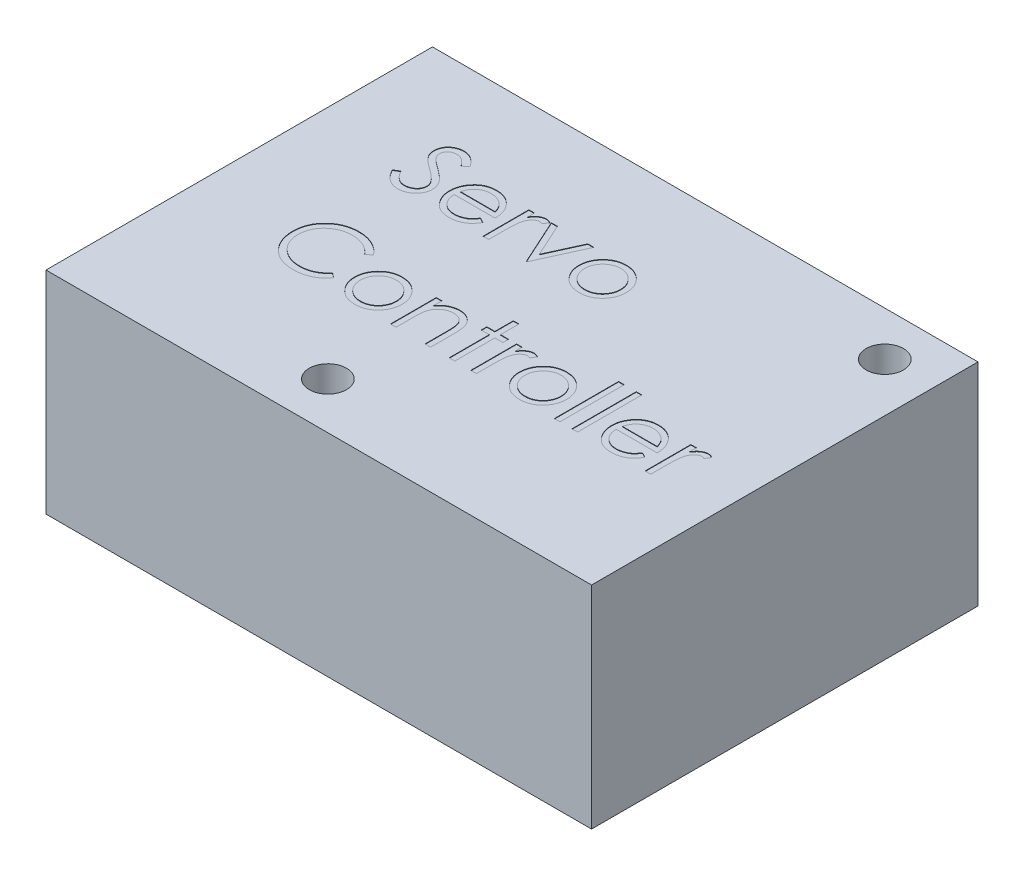
from build123d import *

# Parameters (mm, degrees)
SKETCH1_W                   = 30.48
SKETCH1_H                   = 21.59
BOSS_EXTRUDE1_DEPTH         = 11.811
F_45_0_082_DIAMETER_HOLE1_D = 2.0828
SKETCH6_W                   = 0.314102564
SKETCH6_H                   = 3.589743589
CUT_EXTRUDE1_DEPTH          = 0.0254


with BuildPart() as part:
    # Sketch1 → Boss-Extrude1 (new body)
    with BuildSketch(Plane(origin=(0, 0, 0), x_dir=(1, 0, 0), z_dir=(0, 1, 0))):
        Rectangle(SKETCH1_W, SKETCH1_H)
    extrude(amount=BOSS_EXTRUDE1_DEPTH)

    # #45 (0.082) Diameter Hole1 (through all)
    with Locations(Plane(origin=(0, 0, 0), x_dir=(-1, 0, 0), z_dir=(0, -1, 0))):
        with Locations((2.0955, -8.1915), (-12.5095, 8.3185)):
            Hole(F_45_0_082_DIAMETER_HOLE1_D / 2)

    # Sketch6 → Cut-Extrude1 (cut)
    # profile 1 of 15: a face of its own
    with BuildSketch(Plane(origin=(0, 11.811, 0), x_dir=(1, 0, 0), z_dir=(0, 1, 0))):
        with BuildLine():
            Line((-10.408976815, 3.724664105), (-10.113103417, 3.90204792))
            add(Edge.make_bspline(
                [(-10.113103417, 3.90204792), (-10.08558518, 3.855983535), (-10.0328613, 3.767725951), (-9.94490994, 3.64846791), (-9.853777029, 3.547105753), (-9.758787696, 3.464229146), (-9.660521748, 3.398980259), (-9.558337694, 3.352778027), (-9.452579883, 3.323962052), (-9.380606062, 3.320461966), (-9.34467393, 3.318714586)],
                knots=[0, 0, 0, 0, 1.272034388, 2.437168799, 3.508375237, 4.49857839, 5.41946034, 6.295179144, 7.148887113, 8, 8, 8, 8], degree=3))
            add(Edge.make_bspline(
                [(-9.34467393, 3.318714586), (-9.31398707, 3.319569259), (-9.253150297, 3.321263649), (-9.163588054, 3.337544451), (-9.076606251, 3.36255658), (-8.993997614, 3.398377511), (-8.916901999, 3.441715997), (-8.849295304, 3.494062175), (-8.790849191, 3.55266838), (-8.743040076, 3.618051035), (-8.706360041, 3.688368184), (-8.678167972, 3.760544135), (-8.662522899, 3.835712703), (-8.660166145, 3.886323166), (-8.658976815, 3.911863625)],
                knots=[0, 0, 0, 0, 1.095163259, 2.171163733, 3.241058638, 4.321873601, 5.38011039, 6.391990106, 7.366004449, 8.327778327, 9.272591725, 10.192022065, 11.087607919, 12, 12, 12, 12], degree=3))
            add(Edge.make_bspline(
                [(-8.658976815, 3.911863625), (-8.660451126, 3.941004474), (-8.663448184, 4.000243563), (-8.688779664, 4.087643216), (-8.728628911, 4.174135786), (-8.765391554, 4.227637052), (-8.784477616, 4.255413304)],
                knots=[0, 0, 0, 0, 0.938893495, 1.908633276, 2.914225137, 4, 4, 4, 4], degree=3))
            add(Edge.make_bspline(
                [(-8.784477616, 4.255413304), (-8.80014823, 4.275460128), (-8.833046725, 4.317545926), (-8.889604237, 4.380191162), (-8.955970351, 4.444809581), (-9.029873906, 4.513868638), (-9.114006995, 4.584156434), (-9.20573451, 4.659024712), (-9.307398369, 4.735626289), (-9.378697865, 4.786998855), (-9.415487232, 4.813506253)],
                knots=[0, 0, 0, 0, 0.722233717, 1.516239348, 2.393582979, 3.351407094, 4.387010283, 5.505090956, 6.712668013, 8, 8, 8, 8], degree=3))
            add(Edge.make_bspline(
                [(-9.415487232, 4.813506253), (-9.452311228, 4.83973484), (-9.522715904, 4.889881903), (-9.621174487, 4.964306187), (-9.70921895, 5.032350056), (-9.786457966, 5.094654068), (-9.852857563, 5.151226673), (-9.908940974, 5.201524612), (-9.953279531, 5.246908173), (-9.977935112, 5.276349515), (-9.98900486, 5.289567952)],
                knots=[0, 0, 0, 0, 1.452282411, 2.77665338, 3.964542531, 5.026858415, 5.96415736, 6.766646006, 7.446254459, 8, 8, 8, 8], degree=3))
            add(Edge.make_bspline(
                [(-9.98900486, 5.289567952), (-10.004477405, 5.310168988), (-10.034906242, 5.350683692), (-10.075072247, 5.41400855), (-10.10921141, 5.478831815), (-10.135973742, 5.54532768), (-10.158509961, 5.612562609), (-10.173667892, 5.681413855), (-10.183159289, 5.751572473), (-10.184131275, 5.798785974), (-10.18461784, 5.822420516)],
                knots=[0, 0, 0, 0, 1.068054152, 2.10047183, 3.106115577, 4.101338837, 5.06977816, 6.043150881, 7.020423561, 8, 8, 8, 8], degree=3))
            add(Edge.make_bspline(
                [(-10.18461784, 5.822420516), (-10.183312631, 5.85945029), (-10.180730111, 5.932718354), (-10.158889594, 6.039749184), (-10.124416701, 6.141935602), (-10.076121813, 6.238265935), (-10.01386446, 6.326231916), (-9.941818485, 6.406845403), (-9.856006999, 6.474613985), (-9.761854376, 6.533826044), (-9.658798004, 6.580171969), (-9.5508071, 6.615132949), (-9.437710028, 6.634942207), (-9.361106894, 6.637784972), (-9.322238033, 6.639227407)],
                knots=[0, 0, 0, 0, 1.005424448, 1.989358655, 2.955360095, 3.929531133, 4.905563448, 5.876582895, 6.856512386, 7.866279853, 8.892233794, 9.918561126, 10.94386622, 12, 12, 12, 12], degree=3))
            add(Edge.make_bspline(
                [(-9.322238033, 6.639227407), (-9.280993932, 6.637804855), (-9.198972581, 6.634975854), (-9.078323365, 6.610378323), (-8.962162649, 6.569677651), (-8.868719384, 6.523488993), (-8.795586623, 6.477357577), (-8.73981389, 6.435337753), (-8.683296439, 6.386962644), (-8.625578384, 6.332103398), (-8.567637725, 6.270256647), (-8.508614273, 6.201845958), (-8.448370004, 6.127289402), (-8.409614144, 6.074064902), (-8.389746046, 6.04677949)],
                knots=[0, 0, 0, 0, 1.286793592, 2.559021753, 3.825965368, 5.121522368, 5.803751409, 6.523245864, 7.299691795, 8.125521123, 9.008227632, 9.944561021, 10.946284179, 12, 12, 12, 12], degree=3))
            Line((-8.389746046, 6.04677949), (-8.673700373, 5.831535099))
            add(Edge.make_bspline(
                [(-8.673700373, 5.831535099), (-8.690846305, 5.853623789), (-8.723865362, 5.896161443), (-8.773994849, 5.955732758), (-8.821243497, 6.010149238), (-8.867793897, 6.057414366), (-8.911187528, 6.100116499), (-8.95330457, 6.136676256), (-8.993538922, 6.167451851), (-9.044255832, 6.200295411), (-9.107973551, 6.232851915), (-9.187958087, 6.260400993), (-9.271544362, 6.276956055), (-9.328473993, 6.279144942), (-9.357294123, 6.280253048)],
                knots=[0, 0, 0, 0, 1.181633172, 2.275549214, 3.290209073, 4.226197932, 5.078386478, 5.862611352, 6.581680152, 7.217281963, 8.414376989, 9.595101626, 10.782541182, 12, 12, 12, 12], degree=3))
            add(Edge.make_bspline(
                [(-9.357294123, 6.280253048), (-9.393450645, 6.279041348), (-9.463175092, 6.276704699), (-9.562165328, 6.251184713), (-9.651259254, 6.211002853), (-9.727811819, 6.154687875), (-9.791548796, 6.087966882), (-9.837654254, 6.011188027), (-9.865404419, 5.926405624), (-9.868790699, 5.867263968), (-9.870515276, 5.837144073)],
                knots=[0, 0, 0, 0, 1.14458467, 2.207223713, 3.21896685, 4.227309161, 5.202851033, 6.127160689, 7.046193047, 8, 8, 8, 8], degree=3))
            add(Edge.make_bspline(
                [(-9.870515276, 5.837144073), (-9.87012215, 5.818392595), (-9.869335254, 5.780858975), (-9.858360456, 5.725407553), (-9.844261127, 5.670096214), (-9.821918495, 5.615173631), (-9.791073192, 5.559679272), (-9.750568016, 5.502657535), (-9.699554704, 5.443605826), (-9.660477691, 5.405198452), (-9.639846206, 5.384920516)],
                knots=[0, 0, 0, 0, 0.858281714, 1.717966888, 2.583508476, 3.4729293, 4.427298488, 5.488583878, 6.674047936, 8, 8, 8, 8], degree=3))
            add(Edge.make_bspline(
                [(-9.639846206, 5.384920516), (-9.632184833, 5.37808349), (-9.613983166, 5.361840282), (-9.580707241, 5.335248001), (-9.536764442, 5.302445229), (-9.483302241, 5.261857912), (-9.419334879, 5.21477645), (-9.344855323, 5.161802838), (-9.26069379, 5.101217379), (-9.200971875, 5.058859838), (-9.169393482, 5.036462984)],
                knots=[0, 0, 0, 0, 0.420754252, 0.999615792, 1.744751191, 2.668019286, 3.750313428, 4.999500688, 6.413464383, 8, 8, 8, 8], degree=3))
            add(Edge.make_bspline(
                [(-9.169393482, 5.036462984), (-9.131407568, 5.008821624), (-9.057853112, 4.955297962), (-8.953195532, 4.874882282), (-8.858301724, 4.796234514), (-8.77283852, 4.719856907), (-8.695961612, 4.646328814), (-8.628523891, 4.574765633), (-8.569838211, 4.505680061), (-8.506658992, 4.417107485), (-8.442101173, 4.308326401), (-8.386659665, 4.175048162), (-8.351701318, 4.041251842), (-8.347129802, 3.951325005), (-8.344874251, 3.906955772)],
                knots=[0, 0, 0, 0, 1.163667725, 2.253281268, 3.268753668, 4.215851969, 5.092017293, 5.902905408, 6.650798638, 7.335211899, 8.59617414, 9.77448103, 10.901945474, 12, 12, 12, 12], degree=3))
            add(Edge.make_bspline(
                [(-8.344874251, 3.906955772), (-8.345531389, 3.875577407), (-8.346832904, 3.813430023), (-8.361793818, 3.722174947), (-8.383713483, 3.633544077), (-8.416750717, 3.548632964), (-8.457073875, 3.465888202), (-8.508240123, 3.387480301), (-8.567547808, 3.311673903), (-8.635581573, 3.240490411), (-8.710027475, 3.175144215), (-8.78871117, 3.117015154), (-8.871761443, 3.068546831), (-8.958727759, 3.028995988), (-9.049630096, 2.998062471), (-9.14443788, 2.975649602), (-9.243307391, 2.961893891), (-9.310507873, 2.960466129), (-9.34467393, 2.959740227)],
                knots=[0, 0, 0, 0, 0.983748083, 1.948392443, 2.894712957, 3.844097841, 4.80183111, 5.778335162, 6.776009319, 7.81870978, 8.863265674, 9.881300176, 10.883814829, 11.87499822, 12.874611388, 13.892143829, 14.928324115, 16, 16, 16, 16], degree=3))
            add(Edge.make_bspline(
                [(-9.34467393, 2.959740227), (-9.371109273, 2.960251409), (-9.423647033, 2.961267334), (-9.501356515, 2.970248615), (-9.577496104, 2.982955718), (-9.651110386, 3.003129788), (-9.723147798, 3.027606765), (-9.793295033, 3.057745098), (-9.861586086, 3.093862299), (-9.928403669, 3.135157324), (-9.993577844, 3.183215068), (-10.056497312, 3.239188565), (-10.119226497, 3.30153407), (-10.179913894, 3.371944633), (-10.239787038, 3.449282716), (-10.297665447, 3.5342719), (-10.354747165, 3.626449253), (-10.390562633, 3.691314339), (-10.408976815, 3.724664105)],
                knots=[0, 0, 0, 0, 0.915332311, 1.819136955, 2.706846663, 3.586547465, 4.459518054, 5.340707479, 6.227863349, 7.133153174, 8.059268498, 9.028702269, 10.047606654, 11.120612155, 12.245963614, 13.433783089, 14.680604001, 16, 16, 16, 16], degree=3))
        make_face()
    # profile 2 of 15: a face of its own
    with BuildSketch(Plane(origin=(0, 11.811, 0), x_dir=(1, 0, 0), z_dir=(0, 1, 0))):
        with BuildLine():
            Line((-5.617510469, 3.857176125), (-5.338463994, 3.71064167))
            add(Edge.make_bspline(
                [(-5.338463994, 3.71064167), (-5.36070059, 3.671198338), (-5.403964198, 3.594457235), (-5.478364946, 3.489025375), (-5.556357019, 3.394177659), (-5.641460987, 3.312448005), (-5.731130665, 3.24119662), (-5.82586332, 3.178858795), (-5.926152138, 3.125740275), (-6.032001863, 3.080987747), (-6.144301414, 3.046578253), (-6.26332293, 3.022274032), (-6.389294426, 3.007250763), (-6.475640606, 3.005505622), (-6.519854219, 3.004612022)],
                knots=[0, 0, 0, 0, 1.120438281, 2.179929193, 3.190490725, 4.156257408, 5.095198341, 6.022838206, 6.959905092, 7.901321166, 8.864066838, 9.862729781, 10.905609505, 12, 12, 12, 12], degree=3))
            add(Edge.make_bspline(
                [(-6.519854219, 3.004612022), (-6.568996196, 3.005759197), (-6.664857958, 3.007997004), (-6.804397705, 3.027289469), (-6.935777123, 3.058761827), (-7.058988827, 3.102727369), (-7.173731079, 3.160154693), (-7.280231934, 3.230114175), (-7.37905146, 3.312246429), (-7.467075669, 3.407262873), (-7.546319552, 3.50894483), (-7.616245372, 3.614900715), (-7.674702803, 3.724863939), (-7.722255413, 3.838134463), (-7.760660278, 3.953998357), (-7.787426982, 4.073509824), (-7.80285673, 4.196345408), (-7.805221175, 4.279442744), (-7.806412712, 4.321318753)],
                knots=[0, 0, 0, 0, 1.145258523, 2.234067595, 3.276747158, 4.290159414, 5.277019952, 6.260822364, 7.254936242, 8.264827045, 9.274100331, 10.257902744, 11.220704747, 12.172965371, 13.118907548, 14.062713208, 15.023725156, 16, 16, 16, 16], degree=3))
            add(Edge.make_bspline(
                [(-7.806412712, 4.321318753), (-7.805353571, 4.360613583), (-7.803254493, 4.438490748), (-7.790023705, 4.553756292), (-7.766575412, 4.665784745), (-7.734399088, 4.774669193), (-7.692847842, 4.880227327), (-7.642015623, 4.982523391), (-7.581823245, 5.08144853), (-7.535350571, 5.143851664), (-7.511941558, 5.175285099)],
                knots=[0, 0, 0, 0, 1.024358464, 2.0301432, 3.019427413, 4.004406732, 4.986367066, 5.972626655, 6.978780325, 8, 8, 8, 8], degree=3))
            add(Edge.make_bspline(
                [(-7.511941558, 5.175285099), (-7.480233876, 5.213153969), (-7.417822929, 5.28769212), (-7.312266574, 5.385630445), (-7.197966377, 5.46767422), (-7.076354751, 5.535681357), (-6.946018277, 5.587355004), (-6.808708986, 5.625862586), (-6.6628634, 5.647440597), (-6.563158179, 5.650488431), (-6.512141879, 5.65204792)],
                knots=[0, 0, 0, 0, 1.030682036, 2.02871468, 2.997146059, 3.962720338, 4.930598197, 5.918074684, 6.934738563, 8, 8, 8, 8], degree=3))
            add(Edge.make_bspline(
                [(-6.512141879, 5.65204792), (-6.459694274, 5.650693871), (-6.356804028, 5.648037535), (-6.206771907, 5.623411202), (-6.06481119, 5.584358647), (-5.930978686, 5.529204857), (-5.805260825, 5.458045305), (-5.688474775, 5.369903464), (-5.578623263, 5.267485376), (-5.514714684, 5.188722167), (-5.482193962, 5.148642471)],
                knots=[0, 0, 0, 0, 1.056321875, 2.072262726, 3.055038591, 4.01806755, 4.982017516, 5.957941055, 6.960871419, 8, 8, 8, 8], degree=3))
            add(Edge.make_bspline(
                [(-5.482193962, 5.148642471), (-5.460067024, 5.118438889), (-5.415960431, 5.058232771), (-5.360713331, 4.960061614), (-5.312755936, 4.857351019), (-5.274422975, 4.748440722), (-5.243383474, 4.634621142), (-5.220926655, 4.515078597), (-5.207757036, 4.389848686), (-5.205168339, 4.30452213), (-5.20384861, 4.261022278)],
                knots=[0, 0, 0, 0, 0.94817472, 1.890038105, 2.849395472, 3.817997239, 4.812318967, 5.836947057, 6.897266129, 8, 8, 8, 8], degree=3))
            Line((-5.20384861, 4.261022278), (-7.492310148, 4.261022278))
            add(Edge.make_bspline(
                [(-7.492310148, 4.261022278), (-7.490770542, 4.227321814), (-7.487742968, 4.16105121), (-7.473627825, 4.064080427), (-7.451379051, 3.971707085), (-7.420109988, 3.884624043), (-7.382243143, 3.801693916), (-7.335857426, 3.723531879), (-7.280517872, 3.650493949), (-7.218792173, 3.581926811), (-7.150085078, 3.52086605), (-7.07780233, 3.466214274), (-7.000908765, 3.420408677), (-6.920010682, 3.383228787), (-6.835238897, 3.354122471), (-6.746566702, 3.334254651), (-6.654168585, 3.320947544), (-6.591182851, 3.319467878), (-6.559117039, 3.318714586)],
                knots=[0, 0, 0, 0, 1.094153842, 2.151609401, 3.174256925, 4.172055639, 5.149267565, 6.128595816, 7.11444997, 8.118368179, 9.117203808, 10.09244225, 11.054858984, 12.015122123, 12.976791628, 13.957293641, 14.960065497, 16, 16, 16, 16], degree=3))
            add(Edge.make_bspline(
                [(-6.559117039, 3.318714586), (-6.527765892, 3.319322643), (-6.465559201, 3.320529144), (-6.372918343, 3.332261055), (-6.281778816, 3.35123133), (-6.192517833, 3.377121321), (-6.106946987, 3.408698173), (-6.027701437, 3.44680103), (-5.954821221, 3.488950777), (-5.886704254, 3.537160452), (-5.820633261, 3.596168639), (-5.755090775, 3.66980436), (-5.684814121, 3.756891888), (-5.640824529, 3.822437554), (-5.617510469, 3.857176125)],
                knots=[0, 0, 0, 0, 0.99110716, 1.966546729, 2.947904876, 3.932708344, 4.903319531, 5.828989031, 6.710028674, 7.56322171, 8.463672341, 9.504779593, 10.677557249, 12, 12, 12, 12], degree=3))
        make_face()
        with BuildLine():
            add(Edge.make_bspline(
                [(-5.517951174, 4.575124843), (-5.529447798, 4.616787716), (-5.5515751, 4.696975337), (-5.597811464, 4.808016227), (-5.649883005, 4.906704128), (-5.711504736, 4.992283761), (-5.781323462, 5.068287274), (-5.861968645, 5.13470586), (-5.952404538, 5.194123311), (-6.052163679, 5.24427581), (-6.157805464, 5.286965669), (-6.268411656, 5.315590785), (-6.381269444, 5.335200327), (-6.45760373, 5.337026435), (-6.496016078, 5.337945355)],
                knots=[0, 0, 0, 0, 1.154881502, 2.222775134, 3.210006277, 4.132804581, 5.035138423, 5.962687519, 6.919655026, 7.923214229, 8.944639381, 9.960483929, 10.97369054, 12, 12, 12, 12], degree=3))
            add(Edge.make_bspline(
                [(-6.496016078, 5.337945355), (-6.527365516, 5.337333684), (-6.589336765, 5.336124538), (-6.680637833, 5.324654408), (-6.768317532, 5.305694564), (-6.85302282, 5.279729607), (-6.933643688, 5.245121005), (-7.011838457, 5.204537778), (-7.085618853, 5.154996194), (-7.131760148, 5.117237339), (-7.155070565, 5.098161702)],
                knots=[0, 0, 0, 0, 1.04873581, 2.073130211, 3.073294108, 4.04793562, 5.032784715, 6.005352987, 6.992311501, 8, 8, 8, 8], degree=3))
            add(Edge.make_bspline(
                [(-7.155070565, 5.098161702), (-7.171763847, 5.083067386), (-7.205546981, 5.05252017), (-7.250687503, 4.999890963), (-7.293907975, 4.943139401), (-7.333241628, 4.880094277), (-7.369319214, 4.811473498), (-7.403079192, 4.737855862), (-7.433465604, 4.658682732), (-7.450561714, 4.603510293), (-7.459357424, 4.575124843)],
                knots=[0, 0, 0, 0, 0.879870761, 1.780643979, 2.707998968, 3.669668524, 4.684282772, 5.740141944, 6.837334558, 8, 8, 8, 8], degree=3))
            Line((-7.459357424, 4.575124843), (-5.517951174, 4.575124843))
        make_face(mode=Mode.SUBTRACT)
    # profile 3 of 15: a face of its own
    with BuildSketch(Plane(origin=(0, 11.811, 0), x_dir=(1, 0, 0), z_dir=(0, 1, 0))):
        with BuildLine():
            Line((-4.665387071, 5.607176125), (-4.351284507, 5.607176125))
            Line((-4.351284507, 5.607176125), (-4.351284507, 5.230673721))
            add(Edge.make_bspline(
                [(-4.351284507, 5.230673721), (-4.328095748, 5.265729549), (-4.283747427, 5.332773548), (-4.210034498, 5.421442849), (-4.134531167, 5.494857896), (-4.05687598, 5.553361415), (-3.97649788, 5.597174534), (-3.895160928, 5.629267569), (-3.811585458, 5.648244884), (-3.755423534, 5.650778543), (-3.72728611, 5.65204792)],
                knots=[0, 0, 0, 0, 1.2804753, 2.448899062, 3.506932113, 4.484331642, 5.4025378, 6.288909075, 7.142734305, 8, 8, 8, 8], degree=3))
            add(Edge.make_bspline(
                [(-3.72728611, 5.65204792), (-3.705459783, 5.650857393), (-3.660550698, 5.648407807), (-3.592568108, 5.631196982), (-3.522524656, 5.60371896), (-3.477382269, 5.577878737), (-3.45384861, 5.564407695)],
                knots=[0, 0, 0, 0, 0.901110191, 1.854092781, 2.881294221, 4, 4, 4, 4], degree=3))
            Line((-3.45384861, 5.564407695), (-3.626324571, 5.292372439))
            add(Edge.make_bspline(
                [(-3.626324571, 5.292372439), (-3.641433592, 5.299112705), (-3.670113407, 5.31190702), (-3.712067973, 5.32704903), (-3.75074931, 5.335964946), (-3.775392868, 5.337315664), (-3.786881462, 5.337945355)],
                knots=[0, 0, 0, 0, 1.180555205, 2.24091978, 3.179933427, 4, 4, 4, 4], degree=3))
            add(Edge.make_bspline(
                [(-3.786881462, 5.337945355), (-3.812087196, 5.336265318), (-3.863499586, 5.332838529), (-3.938984085, 5.305899721), (-4.012231291, 5.262374481), (-4.070402953, 5.214103369), (-4.115445206, 5.167555572), (-4.147585431, 5.126907169), (-4.177068178, 5.081328538), (-4.205238399, 5.031598854), (-4.230904693, 4.976869008), (-4.254859362, 4.917685794), (-4.276518225, 4.853980665), (-4.288868469, 4.809598145), (-4.295194764, 4.786863625)],
                knots=[0, 0, 0, 0, 1.125678352, 2.296057538, 3.5422874, 4.923748041, 5.663163013, 6.437101912, 7.23742474, 8.08941207, 8.991984279, 9.93940061, 10.944477711, 12, 12, 12, 12], degree=3))
            add(Edge.make_bspline(
                [(-4.295194764, 4.786863625), (-4.299927157, 4.766586451), (-4.310409049, 4.721674052), (-4.320600586, 4.646325528), (-4.330670104, 4.557301869), (-4.337766723, 4.454355276), (-4.344344765, 4.337742832), (-4.348054847, 4.207286886), (-4.351157988, 4.062853535), (-4.351241055, 3.961879182), (-4.351284507, 3.909059137)],
                knots=[0, 0, 0, 0, 0.566838948, 1.255505196, 2.06880316, 3.007127437, 4.065329342, 5.249902469, 6.561414163, 8, 8, 8, 8], degree=3))
            Line((-4.351284507, 3.909059137), (-4.351284507, 3.049483817))
            Line((-4.351284507, 3.049483817), (-4.665387071, 3.049483817))
            Line((-4.665387071, 3.049483817), (-4.665387071, 5.607176125))
        make_face()
    # profile 4 of 15: a face of its own
    with BuildSketch(Plane(origin=(0, 11.811, 0), x_dir=(1, 0, 0), z_dir=(0, 1, 0))):
        Polygon((-3.408976815, 5.607176125), (-3.068932744, 5.607176125), (-2.219874251, 3.744996637), (-1.370815757, 5.607176125), (-1.030771687, 5.607176125), (-2.197438353, 3.049483817), (-2.242310148, 3.049483817), align=None)
    # profile 5 of 15: a face of its own
    with BuildSketch(Plane(origin=(0, 11.811, 0), x_dir=(1, 0, 0), z_dir=(0, 1, 0))):
        with BuildLine():
            add(Edge.make_bspline(
                [(0.743066454, 5.65204792), (0.791057727, 5.651026028), (0.885156885, 5.64902235), (1.022964771, 5.627607384), (1.154509907, 5.59486002), (1.280296099, 5.549588457), (1.398712394, 5.488906507), (1.511483638, 5.416497216), (1.618300647, 5.330714622), (1.682323676, 5.264356554), (1.714821262, 5.230673721)],
                knots=[0, 0, 0, 0, 1.054011418, 2.066658804, 3.057071809, 4.030435133, 4.997543892, 5.974964718, 6.972108034, 8, 8, 8, 8], degree=3))
            add(Edge.make_bspline(
                [(1.714821262, 5.230673721), (1.742803216, 5.198459735), (1.798225596, 5.134655193), (1.869291315, 5.03119958), (1.930512875, 4.924059479), (1.979575836, 4.811812153), (2.01826086, 4.695437481), (2.045726556, 4.57453547), (2.062063491, 4.449373123), (2.064266458, 4.364369285), (2.06538216, 4.321318753)],
                knots=[0, 0, 0, 0, 1.025258237, 2.030674902, 3.01204498, 3.988269485, 4.97094183, 5.956517959, 6.965070386, 8, 8, 8, 8], degree=3))
            add(Edge.make_bspline(
                [(2.06538216, 4.321318753), (2.064400822, 4.278018695), (2.062461654, 4.192455762), (2.044118037, 4.066436396), (2.015586952, 3.944241573), (1.974755113, 3.82638288), (1.922397004, 3.712500052), (1.858506317, 3.603090503), (1.782634699, 3.49793837), (1.696630703, 3.397936531), (1.601578827, 3.305770317), (1.498462678, 3.225442047), (1.389308645, 3.156620523), (1.272665291, 3.101184107), (1.149597804, 3.057474407), (1.019840736, 3.02677439), (0.883595666, 3.008212707), (0.790568445, 3.005829133), (0.743066454, 3.004612022)],
                knots=[0, 0, 0, 0, 0.998656419, 1.973391657, 2.932242238, 3.890759089, 4.846373663, 5.82037756, 6.809684879, 7.83454468, 8.860553229, 9.859544525, 10.845671541, 11.83227036, 12.833544569, 13.85385346, 14.904124723, 16, 16, 16, 16], degree=3))
            add(Edge.make_bspline(
                [(0.743066454, 3.004612022), (0.695331735, 3.005833218), (0.601840875, 3.008224993), (0.465114893, 3.026702276), (0.335125274, 3.057460258), (0.211896676, 3.101327751), (0.094751829, 3.156622295), (-0.015034668, 3.225233984), (-0.118234584, 3.305794139), (-0.213306568, 3.397930076), (-0.299305173, 3.497940033), (-0.375178182, 3.603090071), (-0.439068508, 3.712500165), (-0.491426712, 3.82638285), (-0.532258525, 3.944241581), (-0.560789617, 4.066436394), (-0.579133232, 4.192455762), (-0.5810724, 4.278018695), (-0.582053738, 4.321318753)],
                knots=[0, 0, 0, 0, 1.099876186, 2.154163076, 3.173186993, 4.173200201, 5.163417411, 6.152872554, 7.150605724, 8.17532212, 9.198891216, 10.186952605, 11.159729845, 12.11414092, 13.071450619, 14.029093627, 15.002601286, 16, 16, 16, 16], degree=3))
            add(Edge.make_bspline(
                [(-0.582053738, 4.321318753), (-0.580930428, 4.364135299), (-0.578706466, 4.448904701), (-0.562385957, 4.573831762), (-0.535027401, 4.694529151), (-0.496296004, 4.810454627), (-0.446780813, 4.922210063), (-0.386419525, 5.029614894), (-0.314628893, 5.132602694), (-0.259426941, 5.196324774), (-0.23149284, 5.228570355)],
                knots=[0, 0, 0, 0, 1.031353054, 2.041901799, 3.029428768, 4.008703097, 4.981709435, 5.96992636, 6.972712378, 8, 8, 8, 8], degree=3))
            add(Edge.make_bspline(
                [(-0.23149284, 5.228570355), (-0.199044249, 5.262545295), (-0.135228386, 5.329362991), (-0.027879658, 5.414895515), (0.084614163, 5.488811589), (0.204339089, 5.548287804), (0.330021947, 5.595126322), (0.46224119, 5.627691837), (0.600516705, 5.648945192), (0.695076326, 5.65100337), (0.743066454, 5.65204792)],
                knots=[0, 0, 0, 0, 1.027980169, 2.021703884, 2.998553061, 3.971491411, 4.943284454, 5.930300938, 6.949603206, 8, 8, 8, 8], degree=3))
        make_face()
        with BuildLine():
            add(Edge.make_bspline(
                [(0.741664211, 5.337945355), (0.707726599, 5.336980764), (0.640727471, 5.335076481), (0.542107886, 5.320592576), (0.447167732, 5.297645072), (0.355726888, 5.265041016), (0.268093716, 5.222942117), (0.184184313, 5.171233757), (0.103751873, 5.110600801), (0.02836981, 5.041138129), (-0.040812502, 4.965259134), (-0.101290479, 4.884410775), (-0.152715585, 4.799904429), (-0.195555744, 4.711652218), (-0.227462932, 4.618759804), (-0.250635955, 4.522279173), (-0.265106195, 4.422013756), (-0.266992574, 4.353852738), (-0.267951174, 4.319215387)],
                knots=[0, 0, 0, 0, 1.021534396, 2.016698045, 2.994645724, 3.958388632, 4.93408049, 5.916473867, 6.921342795, 7.962252576, 8.998418191, 10.008913653, 10.997312074, 11.973003931, 12.956656626, 13.948281152, 14.957379055, 16, 16, 16, 16], degree=3))
            add(Edge.make_bspline(
                [(-0.267951174, 4.319215387), (-0.26634435, 4.27446336), (-0.263155106, 4.185638955), (-0.237219869, 4.054827832), (-0.193833589, 3.92924598), (-0.13524631, 3.809629594), (-0.061840091, 3.698957316), (0.024646976, 3.600285832), (0.123286676, 3.51510002), (0.232903176, 3.444419175), (0.351257494, 3.388259419), (0.476513815, 3.348460443), (0.607154509, 3.322588751), (0.69643524, 3.320017276), (0.741664211, 3.318714586)],
                knots=[0, 0, 0, 0, 1.016792936, 2.018143844, 3.017858371, 4.030088057, 5.03801393, 6.028138512, 7.003788237, 7.991172063, 8.984598303, 9.972568034, 10.972917682, 12, 12, 12, 12], degree=3))
            add(Edge.make_bspline(
                [(0.741664211, 3.318714586), (0.78689058, 3.320024866), (0.876166176, 3.322611323), (1.006625353, 3.348330143), (1.131539324, 3.388433804), (1.249770712, 3.444356014), (1.359337315, 3.515368428), (1.458686437, 3.599804805), (1.544435048, 3.699218657), (1.617768653, 3.809776186), (1.677315395, 3.929060538), (1.720498597, 4.05485101), (1.746496183, 4.185633052), (1.749677012, 4.274461383), (1.751279595, 4.319215387)],
                knots=[0, 0, 0, 0, 1.02726834, 2.027799167, 3.010890988, 4.004497153, 4.992059811, 5.971914811, 6.958719428, 7.966827853, 8.981595046, 9.981490638, 10.983022906, 12, 12, 12, 12], degree=3))
            add(Edge.make_bspline(
                [(1.751279595, 4.319215387), (1.750321325, 4.353852945), (1.748435596, 4.422014371), (1.733960632, 4.522276824), (1.710805092, 4.618768421), (1.678833475, 4.711620424), (1.636179461, 4.800132929), (1.583762668, 4.884162656), (1.523531643, 4.965539202), (1.453514522, 5.040892843), (1.378211144, 5.110627879), (1.297746106, 5.171257269), (1.213961127, 5.222714864), (1.126582544, 5.265401105), (1.035129977, 5.297348445), (0.940322848, 5.320725076), (0.842124038, 5.335015273), (0.775364994, 5.336962415), (0.741664211, 5.337945355)],
                knots=[0, 0, 0, 0, 1.042956736, 2.052379634, 3.044323526, 4.02829302, 5.004299113, 5.996692471, 7.007513377, 8.048758398, 9.090003419, 10.095195979, 11.07790575, 12.047570684, 13.018257071, 13.989683339, 14.985167495, 16, 16, 16, 16], degree=3))
        make_face(mode=Mode.SUBTRACT)
    # profile 6 of 15: a face of its own
    with BuildSketch(Plane(origin=(0, 11.811, 0), x_dir=(1, 0, 0), z_dir=(0, 1, 0))):
        with BuildLine():
            Line((-6.819233225, -0.92607708), (-7.094072969, -1.136413619))
            add(Edge.make_bspline(
                [(-7.094072969, -1.136413619), (-7.113678857, -1.113047649), (-7.152626304, -1.066630733), (-7.215285506, -1.001451189), (-7.280587149, -0.940385928), (-7.348506271, -0.883144048), (-7.42026539, -0.831727282), (-7.494126189, -0.783456179), (-7.571324234, -0.740188441), (-7.678075969, -0.687725455), (-7.817723817, -0.6329793), (-7.993518656, -0.587076069), (-8.177029754, -0.557854893), (-8.302227354, -0.554690052), (-8.365907905, -0.553080286)],
                knots=[0, 0, 0, 0, 0.757959112, 1.505699292, 2.245454638, 2.979532153, 3.711538275, 4.438200793, 5.171680507, 5.909471876, 7.393775596, 8.890124382, 10.418191784, 12, 12, 12, 12], degree=3))
            add(Edge.make_bspline(
                [(-8.365907905, -0.553080286), (-8.400991204, -0.553484248), (-8.470832197, -0.554288424), (-8.57448067, -0.564897549), (-8.676193721, -0.579808759), (-8.775905187, -0.601934082), (-8.873488146, -0.629906702), (-8.969580548, -0.663332115), (-9.062791148, -0.704686955), (-9.154409386, -0.750395215), (-9.242188597, -0.80202266), (-9.325243645, -0.858336012), (-9.403271613, -0.918705108), (-9.476334225, -0.983356215), (-9.544506173, -1.051998175), (-9.607293484, -1.125362517), (-9.664478894, -1.20321469), (-9.717195919, -1.284528098), (-9.764408653, -1.36906589), (-9.803938532, -1.45714096), (-9.838943654, -1.547245063), (-9.866642897, -1.640396224), (-9.888567414, -1.73593899), (-9.903695077, -1.834129778), (-9.914183548, -1.934763457), (-9.914983725, -2.00297277), (-9.915387071, -2.037355125)],
                knots=[0, 0, 0, 0, 1.054917814, 2.100044995, 3.131103042, 4.146048494, 5.169673617, 6.183595914, 7.203665975, 8.234915748, 9.262203917, 10.264457458, 11.251630812, 12.227803204, 13.197192746, 14.159520551, 15.12972552, 16.100847026, 17.073214652, 18.039054194, 19.002613845, 19.979014051, 20.95965708, 21.949030935, 22.966165397, 24, 24, 24, 24], degree=3))
            add(Edge.make_bspline(
                [(-9.915387071, -2.037355125), (-9.914125252, -2.089086445), (-9.911647838, -2.19065403), (-9.889599504, -2.339424641), (-9.856094413, -2.481945314), (-9.805878836, -2.617325157), (-9.743959785, -2.747233515), (-9.665719174, -2.869472368), (-9.575102636, -2.985888933), (-9.470828217, -3.09373188), (-9.356422401, -3.192245606), (-9.233674489, -3.278996187), (-9.102890201, -3.35131107), (-8.965513571, -3.411487016), (-8.820487457, -3.457743744), (-8.668072655, -3.490307867), (-8.50860066, -3.511550048), (-8.39963126, -3.513583736), (-8.344173129, -3.514618747)],
                knots=[0, 0, 0, 0, 1.029171465, 2.020641659, 2.987623507, 3.938342917, 4.889210282, 5.84687017, 6.821220943, 7.821438502, 8.827599549, 9.822697543, 10.807740252, 11.797342354, 12.80366471, 13.83203677, 14.896651826, 16, 16, 16, 16], degree=3))
            add(Edge.make_bspline(
                [(-8.344173129, -3.514618747), (-8.28307044, -3.512929967), (-8.162805731, -3.509606045), (-7.986437705, -3.481446796), (-7.817601939, -3.435788878), (-7.656289353, -3.371890956), (-7.502954706, -3.288825668), (-7.357358046, -3.18812779), (-7.219376476, -3.068839458), (-7.136405193, -2.977756329), (-7.094072969, -2.931285414)],
                knots=[0, 0, 0, 0, 1.028121516, 2.023589091, 2.998037872, 3.967518031, 4.937445131, 5.927275754, 6.942489185, 8, 8, 8, 8], degree=3))
            Line((-7.094072969, -2.931285414), (-6.819233225, -3.139518587))
            add(Edge.make_bspline(
                [(-6.819233225, -3.139518587), (-6.841351335, -3.168057039), (-6.88548161, -3.224997245), (-6.956939627, -3.305268955), (-7.032216925, -3.38077299), (-7.111872635, -3.450900612), (-7.194990426, -3.517055077), (-7.283062739, -3.577356908), (-7.374931771, -3.632647793), (-7.47028625, -3.683274717), (-7.569024863, -3.728191964), (-7.671029298, -3.766645732), (-7.775859873, -3.799770622), (-7.883521382, -3.827022558), (-7.994237138, -3.848293642), (-8.107607613, -3.862513317), (-8.223877488, -3.872255231), (-8.302318909, -3.873143147), (-8.342069764, -3.873593106)],
                knots=[0, 0, 0, 0, 0.986787822, 1.968848986, 2.935600012, 3.899624008, 4.868462664, 5.837806735, 6.815139263, 7.798259679, 8.787526145, 9.778297419, 10.776456485, 11.791383307, 12.812564526, 13.85620153, 14.913611965, 16, 16, 16, 16], degree=3))
            add(Edge.make_bspline(
                [(-8.342069764, -3.873593106), (-8.379713431, -3.873331114), (-8.454149121, -3.872813056), (-8.564047872, -3.864420888), (-8.671037453, -3.852971151), (-8.774812079, -3.83573102), (-8.875938054, -3.81538668), (-8.973498639, -3.788115424), (-9.068453849, -3.757566257), (-9.16042219, -3.72166127), (-9.249481889, -3.681145088), (-9.335345701, -3.635353529), (-9.417974133, -3.584671664), (-9.498179554, -3.530216654), (-9.574777138, -3.470239352), (-9.648430663, -3.405572717), (-9.719553139, -3.336434707), (-9.763555824, -3.286579853), (-9.785679539, -3.261513779)],
                knots=[0, 0, 0, 0, 1.114604814, 2.203992996, 3.262667896, 4.300477797, 5.318619304, 6.316056647, 7.298880507, 8.271930387, 9.238335007, 10.195173496, 11.151986948, 12.108099108, 13.064862484, 14.031167946, 15.010108607, 16, 16, 16, 16], degree=3))
            add(Edge.make_bspline(
                [(-9.785679539, -3.261513779), (-9.821115183, -3.21797259), (-9.89155866, -3.13141588), (-9.981684343, -2.991129899), (-10.058831898, -2.84466169), (-10.121207819, -2.691241761), (-10.169970552, -2.531214374), (-10.203751747, -2.364498859), (-10.225703352, -2.191250917), (-10.228213641, -2.073414128), (-10.229489635, -2.013516984)],
                knots=[0, 0, 0, 0, 0.994628077, 1.977248131, 2.950237994, 3.925870899, 4.908910175, 5.911660606, 6.938484602, 8, 8, 8, 8], degree=3))
            add(Edge.make_bspline(
                [(-10.229489635, -2.013516984), (-10.227934442, -1.950561531), (-10.224874696, -1.826700606), (-10.1988789, -1.644926653), (-10.157060104, -1.470775254), (-10.097663215, -1.30457151), (-10.022357864, -1.145441229), (-9.92933125, -0.994600024), (-9.819664108, -0.851083225), (-9.69421654, -0.717068473), (-9.556649205, -0.594529121), (-9.409330391, -0.486722917), (-9.252548444, -0.397005401), (-9.088030592, -0.322009239), (-8.914544911, -0.264364776), (-8.732461542, -0.224011589), (-8.542122627, -0.198894473), (-8.412260201, -0.195719265), (-8.346276494, -0.194105927)],
                knots=[0, 0, 0, 0, 1.032925535, 2.032216505, 3.007276963, 3.968222605, 4.92396291, 5.891752235, 6.871517503, 7.883894988, 8.900124299, 9.891468569, 10.874487609, 11.85992873, 12.854644235, 13.869047385, 14.917252991, 16, 16, 16, 16], degree=3))
            add(Edge.make_bspline(
                [(-8.346276494, -0.194105927), (-8.306062022, -0.194588065), (-8.226461525, -0.195542409), (-8.108708873, -0.204848551), (-7.994066546, -0.220362157), (-7.882455564, -0.241478227), (-7.773332948, -0.267685548), (-7.667532707, -0.301825847), (-7.56443402, -0.340862378), (-7.464687112, -0.385820844), (-7.368770561, -0.436287585), (-7.276714243, -0.491703209), (-7.189249384, -0.551999014), (-7.105760536, -0.61666219), (-7.027644325, -0.687060749), (-6.952682846, -0.761258345), (-6.883421768, -0.841392169), (-6.840668573, -0.897797103), (-6.819233225, -0.92607708)],
                knots=[0, 0, 0, 0, 1.096760587, 2.17092713, 3.219439832, 4.250915756, 5.268269357, 6.278326846, 7.281116186, 8.274029601, 9.260640565, 10.235837813, 11.203064059, 12.156899882, 13.114053108, 14.069676657, 15.032185724, 16, 16, 16, 16], degree=3))
        make_face()
    # profile 7 of 15: a face of its own
    with BuildSketch(Plane(origin=(0, 11.811, 0), x_dir=(1, 0, 0), z_dir=(0, 1, 0))):
        with BuildLine():
            add(Edge.make_bspline(
                [(-4.955651494, -1.181285414), (-4.907660221, -1.182307305), (-4.813561064, -1.184310984), (-4.675753178, -1.205725949), (-4.544208042, -1.238473314), (-4.41842185, -1.283744876), (-4.300005554, -1.344426826), (-4.18723431, -1.416836118), (-4.080417301, -1.502618711), (-4.016394272, -1.568976779), (-3.983896687, -1.602659613)],
                knots=[0, 0, 0, 0, 1.054011418, 2.066658804, 3.057071809, 4.030435133, 4.997543892, 5.974964718, 6.972108034, 8, 8, 8, 8], degree=3))
            add(Edge.make_bspline(
                [(-3.983896687, -1.602659613), (-3.955914733, -1.634873598), (-3.900492352, -1.698678141), (-3.829426634, -1.802133754), (-3.768205073, -1.909273854), (-3.719142112, -2.021521181), (-3.680457089, -2.137895852), (-3.652991392, -2.258797863), (-3.636654458, -2.38396021), (-3.634451491, -2.468964048), (-3.633335789, -2.51201458)],
                knots=[0, 0, 0, 0, 1.025258237, 2.030674902, 3.01204498, 3.988269485, 4.97094183, 5.956517959, 6.965070386, 8, 8, 8, 8], degree=3))
            add(Edge.make_bspline(
                [(-3.633335789, -2.51201458), (-3.634317127, -2.555314638), (-3.636256295, -2.640877571), (-3.654599911, -2.766896937), (-3.683130997, -2.88909176), (-3.723962835, -3.006950454), (-3.776320945, -3.120833281), (-3.840211632, -3.23024283), (-3.916083249, -3.335394964), (-4.002087246, -3.435396802), (-4.097139122, -3.527563017), (-4.20025527, -3.607891286), (-4.309409304, -3.676712811), (-4.426052657, -3.732149226), (-4.549120144, -3.775858927), (-4.678877212, -3.806558943), (-4.815122283, -3.825120627), (-4.908149504, -3.8275042), (-4.955651494, -3.828721311)],
                knots=[0, 0, 0, 0, 0.998656419, 1.973391657, 2.932242238, 3.890759089, 4.846373663, 5.82037756, 6.809684879, 7.83454468, 8.860553229, 9.859544525, 10.845671541, 11.83227036, 12.833544569, 13.85385346, 14.904124723, 16, 16, 16, 16], degree=3))
            add(Edge.make_bspline(
                [(-4.955651494, -3.828721311), (-5.003386214, -3.827500115), (-5.096877074, -3.825108341), (-5.233603055, -3.806631058), (-5.363592674, -3.775873075), (-5.486821273, -3.732005583), (-5.60396612, -3.676711039), (-5.713752617, -3.608099349), (-5.816952532, -3.527539194), (-5.912024517, -3.435403257), (-5.998023122, -3.335393301), (-6.07389613, -3.230243262), (-6.137786457, -3.120833169), (-6.19014466, -3.006950484), (-6.230976473, -2.889091752), (-6.259507566, -2.766896939), (-6.277851181, -2.640877571), (-6.279790349, -2.555314638), (-6.280771687, -2.51201458)],
                knots=[0, 0, 0, 0, 1.099876186, 2.154163076, 3.173186993, 4.173200201, 5.163417411, 6.152872554, 7.150605724, 8.17532212, 9.198891216, 10.186952605, 11.159729845, 12.11414092, 13.071450619, 14.029093627, 15.002601286, 16, 16, 16, 16], degree=3))
            add(Edge.make_bspline(
                [(-6.280771687, -2.51201458), (-6.279648376, -2.469198035), (-6.277424415, -2.384428632), (-6.261103906, -2.259501572), (-6.233745349, -2.138804182), (-6.195013953, -2.022878706), (-6.145498762, -1.91112327), (-6.085137474, -1.803718439), (-6.013346841, -1.700730639), (-5.95814489, -1.637008559), (-5.930210789, -1.604762978)],
                knots=[0, 0, 0, 0, 1.031353054, 2.041901799, 3.029428768, 4.008703097, 4.981709435, 5.96992636, 6.972712378, 8, 8, 8, 8], degree=3))
            add(Edge.make_bspline(
                [(-5.930210789, -1.604762978), (-5.897762198, -1.570788039), (-5.833946334, -1.503970342), (-5.726597607, -1.418437818), (-5.614103785, -1.344521745), (-5.494378859, -1.285045529), (-5.368696001, -1.238207011), (-5.236476759, -1.205641496), (-5.098201243, -1.184388141), (-5.003641622, -1.182329963), (-4.955651494, -1.181285414)],
                knots=[0, 0, 0, 0, 1.027980169, 2.021703884, 2.998553061, 3.971491411, 4.943284454, 5.930300938, 6.949603206, 8, 8, 8, 8], degree=3))
        make_face()
        with BuildLine():
            add(Edge.make_bspline(
                [(-4.957053738, -1.495387978), (-4.990991349, -1.49635257), (-5.057990478, -1.498256852), (-5.156610063, -1.512740757), (-5.251550217, -1.535688261), (-5.342991061, -1.568292317), (-5.430624233, -1.610391216), (-5.514533636, -1.662099576), (-5.594966075, -1.722732533), (-5.670348139, -1.792195204), (-5.739530451, -1.868074199), (-5.800008428, -1.948922558), (-5.851433534, -2.033428904), (-5.894273693, -2.121681115), (-5.926180881, -2.214573529), (-5.949353903, -2.31105416), (-5.963824144, -2.411319577), (-5.965710522, -2.479480595), (-5.966669123, -2.514117946)],
                knots=[0, 0, 0, 0, 1.021534396, 2.016698045, 2.994645724, 3.958388632, 4.93408049, 5.916473867, 6.921342795, 7.962252576, 8.998418191, 10.008913653, 10.997312074, 11.973003931, 12.956656626, 13.948281152, 14.957379055, 16, 16, 16, 16], degree=3))
            add(Edge.make_bspline(
                [(-5.966669123, -2.514117946), (-5.965062299, -2.558869973), (-5.961873054, -2.647694379), (-5.935937818, -2.778505501), (-5.892551538, -2.904087353), (-5.833964258, -3.023703739), (-5.76055804, -3.134376017), (-5.674070973, -3.233047502), (-5.575431273, -3.318233313), (-5.465814773, -3.388914159), (-5.347460455, -3.445073914), (-5.222204133, -3.48487289), (-5.091563439, -3.510744583), (-5.002282708, -3.513316057), (-4.957053738, -3.514618747)],
                knots=[0, 0, 0, 0, 1.016792936, 2.018143844, 3.017858371, 4.030088057, 5.03801393, 6.028138512, 7.003788237, 7.991172063, 8.984598303, 9.972568034, 10.972917682, 12, 12, 12, 12], degree=3))
            add(Edge.make_bspline(
                [(-4.957053738, -3.514618747), (-4.911827369, -3.513308467), (-4.822551773, -3.51072201), (-4.692092596, -3.48500319), (-4.567178624, -3.44489953), (-4.448947237, -3.38897732), (-4.339380633, -3.317964905), (-4.240031512, -3.233528528), (-4.154282901, -3.134114677), (-4.080949296, -3.023557148), (-4.021402553, -2.904272796), (-3.978219351, -2.778482323), (-3.952221766, -2.647700281), (-3.949040937, -2.558871951), (-3.947438353, -2.514117946)],
                knots=[0, 0, 0, 0, 1.02726834, 2.027799167, 3.010890988, 4.004497153, 4.992059811, 5.971914811, 6.958719428, 7.966827853, 8.981595046, 9.981490638, 10.983022906, 12, 12, 12, 12], degree=3))
            add(Edge.make_bspline(
                [(-3.947438353, -2.514117946), (-3.948396623, -2.479480388), (-3.950282352, -2.411318963), (-3.964757317, -2.311056509), (-3.987912856, -2.214564912), (-4.019884474, -2.121712909), (-4.062538488, -2.033200405), (-4.114955281, -1.949170678), (-4.175186306, -1.867794132), (-4.245203427, -1.792440491), (-4.320506805, -1.722705454), (-4.400971843, -1.662076065), (-4.484756822, -1.610618469), (-4.572135404, -1.567932229), (-4.663587972, -1.535984888), (-4.758395101, -1.512608257), (-4.856593911, -1.49831806), (-4.923352954, -1.496370919), (-4.957053738, -1.495387978)],
                knots=[0, 0, 0, 0, 1.042956736, 2.052379634, 3.044323526, 4.02829302, 5.004299113, 5.996692471, 7.007513377, 8.048758398, 9.090003419, 10.095195979, 11.07790575, 12.047570684, 13.018257071, 13.989683339, 14.985167495, 16, 16, 16, 16], degree=3))
        make_face(mode=Mode.SUBTRACT)
    # profile 8 of 15: a face of its own
    with BuildSketch(Plane(origin=(0, 11.811, 0), x_dir=(1, 0, 0), z_dir=(0, 1, 0))):
        with BuildLine():
            Line((-3.005130661, -1.226157209), (-2.691028097, -1.226157209))
            Line((-2.691028097, -1.226157209), (-2.691028097, -1.68749535))
            add(Edge.make_bspline(
                [(-2.691028097, -1.68749535), (-2.657490462, -1.645652627), (-2.592409511, -1.564455363), (-2.484025177, -1.457734789), (-2.369481277, -1.369789564), (-2.249479274, -1.29968577), (-2.123856264, -1.246839144), (-1.993377994, -1.208673213), (-1.857263287, -1.185788384), (-1.764698851, -1.182798154), (-1.717871046, -1.181285414)],
                knots=[0, 0, 0, 0, 1.12780773, 2.188550248, 3.19190651, 4.159438251, 5.104880172, 6.052711206, 7.014878035, 8, 8, 8, 8], degree=3))
            add(Edge.make_bspline(
                [(-1.717871046, -1.181285414), (-1.670540412, -1.183030609), (-1.577902944, -1.186446378), (-1.443024882, -1.213463069), (-1.317051489, -1.259608324), (-1.200431933, -1.322820394), (-1.09530472, -1.401426868), (-1.002979868, -1.49300465), (-0.926616621, -1.598340733), (-0.875419258, -1.696063889), (-0.84169361, -1.782752683), (-0.820461272, -1.856999433), (-0.802430291, -1.939717585), (-0.786798543, -2.030657174), (-0.776221431, -2.130455364), (-0.76787914, -2.238703056), (-0.761900445, -2.355365186), (-0.761663238, -2.436051814), (-0.761540917, -2.477659613)],
                knots=[0, 0, 0, 0, 1.235846778, 2.418850247, 3.575807741, 4.728682307, 5.871620074, 6.994088408, 8.11269785, 9.256955736, 9.865816715, 10.540099792, 11.271859618, 12.076849838, 12.949306005, 13.892391288, 14.913166135, 16, 16, 16, 16], degree=3))
            Line((-0.761540917, -2.477659613), (-0.761540917, -3.783849516))
            Line((-0.761540917, -3.783849516), (-1.075643482, -3.783849516))
            Line((-1.075643482, -3.783849516), (-1.075643482, -2.580724516))
            add(Edge.make_bspline(
                [(-1.075643482, -2.580724516), (-1.07583669, -2.545902071), (-1.076206264, -2.479292661), (-1.07737191, -2.383923637), (-1.080181717, -2.297437059), (-1.08413003, -2.220039692), (-1.08990906, -2.151805855), (-1.095931692, -2.092596578), (-1.103296668, -2.042487036), (-1.109859582, -2.012321954), (-1.112802937, -1.998793427)],
                knots=[0, 0, 0, 0, 1.430800155, 2.736877192, 3.918605307, 4.986035426, 5.920637409, 6.731861385, 7.431261377, 8, 8, 8, 8], degree=3))
            add(Edge.make_bspline(
                [(-1.112802937, -1.998793427), (-1.123428468, -1.959082242), (-1.143879329, -1.882650497), (-1.194413312, -1.778976144), (-1.258227493, -1.690777957), (-1.336125342, -1.618601235), (-1.427354418, -1.562430398), (-1.531661561, -1.523456444), (-1.648040201, -1.499080174), (-1.729894584, -1.496653042), (-1.772558546, -1.495387978)],
                knots=[0, 0, 0, 0, 1.084156227, 2.086665306, 3.027808233, 3.945421172, 4.874247719, 5.839848303, 6.874090471, 8, 8, 8, 8], degree=3))
            add(Edge.make_bspline(
                [(-1.772558546, -1.495387978), (-1.797826229, -1.495863983), (-1.847830322, -1.496805984), (-1.921980294, -1.506257282), (-1.993904467, -1.521715737), (-2.064324676, -1.542584375), (-2.13183247, -1.571246644), (-2.198596761, -1.603776014), (-2.262103525, -1.644324226), (-2.323706922, -1.689514848), (-2.38101973, -1.739594055), (-2.434348069, -1.792438565), (-2.481886089, -1.848714169), (-2.524954764, -1.907514116), (-2.562133027, -1.969645954), (-2.594586116, -2.034510261), (-2.62212181, -2.102192409), (-2.635804503, -2.149167471), (-2.642650693, -2.172671632)],
                knots=[0, 0, 0, 0, 1.023777757, 2.026029729, 3.023749952, 4.003683103, 4.997618607, 5.993177895, 7.010360494, 8.046726602, 9.087585522, 10.09234134, 11.086953743, 12.070360549, 13.043493632, 14.017870808, 15.008233677, 16, 16, 16, 16], degree=3))
            add(Edge.make_bspline(
                [(-2.642650693, -2.172671632), (-2.646590342, -2.189926835), (-2.65516675, -2.227490509), (-2.66442993, -2.289134929), (-2.672837506, -2.360444904), (-2.679874464, -2.441337221), (-2.684179881, -2.532095096), (-2.688874278, -2.632330934), (-2.690583339, -2.742444422), (-2.690875693, -2.819106115), (-2.691028097, -2.859069869)],
                knots=[0, 0, 0, 0, 0.615963638, 1.340920617, 2.168419149, 3.115676021, 4.16674242, 5.331190069, 6.6087489, 8, 8, 8, 8], degree=3))
            Line((-2.691028097, -2.859069869), (-2.691028097, -3.783849516))
            Line((-2.691028097, -3.783849516), (-3.005130661, -3.783849516))
            Line((-3.005130661, -3.783849516), (-3.005130661, -1.226157209))
        make_face()
    # profile 9 of 15: a face of its own
    with BuildSketch(Plane(origin=(0, 11.811, 0), x_dir=(1, 0, 0), z_dir=(0, 1, 0))):
        Polygon((0.270510365, -0.194105927), (0.584612929, -0.194105927), (0.584612929, -1.226157209), (1.033330877, -1.226157209), (1.033330877, -1.540259773), (0.584612929, -1.540259773), (0.584612929, -3.783849516), (0.270510365, -3.783849516), (0.270510365, -1.540259773), (-0.178207584, -1.540259773), (-0.178207584, -1.226157209), (0.270510365, -1.226157209), align=None)
    # profile 10 of 15: a face of its own
    with BuildSketch(Plane(origin=(0, 11.811, 0), x_dir=(1, 0, 0), z_dir=(0, 1, 0))):
        with BuildLine():
            Line((1.482048826, -1.226157209), (1.79615139, -1.226157209))
            Line((1.79615139, -1.226157209), (1.79615139, -1.602659613))
            add(Edge.make_bspline(
                [(1.79615139, -1.602659613), (1.819340149, -1.567603784), (1.86368847, -1.500559785), (1.937401399, -1.411890484), (2.012904731, -1.338475437), (2.090559918, -1.279971919), (2.170938018, -1.2361588), (2.25227497, -1.204065765), (2.335850439, -1.185088449), (2.392012364, -1.182554791), (2.420149788, -1.181285414)],
                knots=[0, 0, 0, 0, 1.2804753, 2.448899062, 3.506932113, 4.484331642, 5.4025378, 6.288909075, 7.142734305, 8, 8, 8, 8], degree=3))
            add(Edge.make_bspline(
                [(2.420149788, -1.181285414), (2.441976114, -1.18247594), (2.486885199, -1.184925526), (2.554867789, -1.202136351), (2.624911241, -1.229614373), (2.670053628, -1.255454596), (2.693587288, -1.268925638)],
                knots=[0, 0, 0, 0, 0.901110191, 1.854092781, 2.881294221, 4, 4, 4, 4], degree=3))
            Line((2.693587288, -1.268925638), (2.521111326, -1.540960895))
            add(Edge.make_bspline(
                [(2.521111326, -1.540960895), (2.506002305, -1.534220628), (2.477322491, -1.521426313), (2.435367924, -1.506284303), (2.396686588, -1.497368387), (2.372043029, -1.49601767), (2.360554435, -1.495387978)],
                knots=[0, 0, 0, 0, 1.180555205, 2.24091978, 3.179933427, 4, 4, 4, 4], degree=3))
            add(Edge.make_bspline(
                [(2.360554435, -1.495387978), (2.335348702, -1.497068015), (2.283936312, -1.500494805), (2.208451812, -1.527433612), (2.135204607, -1.570958852), (2.077032944, -1.619229964), (2.031990692, -1.665777762), (1.999850466, -1.706426164), (1.970367719, -1.752004796), (1.942197499, -1.80173448), (1.916531204, -1.856464326), (1.892576535, -1.915647539), (1.870917672, -1.979352668), (1.858567428, -2.023735188), (1.852241134, -2.046469709)],
                knots=[0, 0, 0, 0, 1.125678352, 2.296057538, 3.5422874, 4.923748041, 5.663163013, 6.437101912, 7.23742474, 8.08941207, 8.991984279, 9.93940061, 10.944477711, 12, 12, 12, 12], degree=3))
            add(Edge.make_bspline(
                [(1.852241134, -2.046469709), (1.847508741, -2.066746882), (1.837026849, -2.111659281), (1.826835311, -2.187007806), (1.816765793, -2.276031464), (1.809669175, -2.378978057), (1.803091133, -2.495590501), (1.79938105, -2.626046447), (1.79627791, -2.770479798), (1.796194843, -2.871454151), (1.79615139, -2.924274196)],
                knots=[0, 0, 0, 0, 0.566838948, 1.255505196, 2.06880316, 3.007127437, 4.065329342, 5.249902469, 6.561414163, 8, 8, 8, 8], degree=3))
            Line((1.79615139, -2.924274196), (1.79615139, -3.783849516))
            Line((1.79615139, -3.783849516), (1.482048826, -3.783849516))
            Line((1.482048826, -3.783849516), (1.482048826, -1.226157209))
        make_face()
    # profile 11 of 15: a face of its own
    with BuildSketch(Plane(origin=(0, 11.811, 0), x_dir=(1, 0, 0), z_dir=(0, 1, 0))):
        with BuildLine():
            add(Edge.make_bspline(
                [(4.243066454, -1.181285414), (4.291057727, -1.182307305), (4.385156885, -1.184310984), (4.522964771, -1.205725949), (4.654509907, -1.238473314), (4.780296099, -1.283744876), (4.898712394, -1.344426826), (5.011483638, -1.416836118), (5.118300647, -1.502618711), (5.182323676, -1.568976779), (5.214821262, -1.602659613)],
                knots=[0, 0, 0, 0, 1.054011418, 2.066658804, 3.057071809, 4.030435133, 4.997543892, 5.974964718, 6.972108034, 8, 8, 8, 8], degree=3))
            add(Edge.make_bspline(
                [(5.214821262, -1.602659613), (5.242803216, -1.634873598), (5.298225596, -1.698678141), (5.369291315, -1.802133754), (5.430512875, -1.909273854), (5.479575836, -2.021521181), (5.51826086, -2.137895852), (5.545726556, -2.258797863), (5.562063491, -2.38396021), (5.564266458, -2.468964048), (5.56538216, -2.51201458)],
                knots=[0, 0, 0, 0, 1.025258237, 2.030674902, 3.01204498, 3.988269485, 4.97094183, 5.956517959, 6.965070386, 8, 8, 8, 8], degree=3))
            add(Edge.make_bspline(
                [(5.56538216, -2.51201458), (5.564400822, -2.555314638), (5.562461654, -2.640877571), (5.544118037, -2.766896937), (5.515586952, -2.88909176), (5.474755113, -3.006950454), (5.422397004, -3.120833281), (5.358506317, -3.23024283), (5.282634699, -3.335394964), (5.196630703, -3.435396802), (5.101578827, -3.527563017), (4.998462678, -3.607891286), (4.889308645, -3.676712811), (4.772665291, -3.732149226), (4.649597804, -3.775858927), (4.519840736, -3.806558943), (4.383595666, -3.825120627), (4.290568445, -3.8275042), (4.243066454, -3.828721311)],
                knots=[0, 0, 0, 0, 0.998656419, 1.973391657, 2.932242238, 3.890759089, 4.846373663, 5.82037756, 6.809684879, 7.83454468, 8.860553229, 9.859544525, 10.845671541, 11.83227036, 12.833544569, 13.85385346, 14.904124723, 16, 16, 16, 16], degree=3))
            add(Edge.make_bspline(
                [(4.243066454, -3.828721311), (4.195331735, -3.827500115), (4.101840875, -3.825108341), (3.965114893, -3.806631058), (3.835125274, -3.775873075), (3.711896676, -3.732005583), (3.594751829, -3.676711039), (3.484965332, -3.608099349), (3.381765416, -3.527539194), (3.286693432, -3.435403257), (3.200694827, -3.335393301), (3.124821818, -3.230243262), (3.060931492, -3.120833169), (3.008573288, -3.006950484), (2.967741475, -2.889091752), (2.939210383, -2.766896939), (2.920866768, -2.640877571), (2.9189276, -2.555314638), (2.917946262, -2.51201458)],
                knots=[0, 0, 0, 0, 1.099876186, 2.154163076, 3.173186993, 4.173200201, 5.163417411, 6.152872554, 7.150605724, 8.17532212, 9.198891216, 10.186952605, 11.159729845, 12.11414092, 13.071450619, 14.029093627, 15.002601286, 16, 16, 16, 16], degree=3))
            add(Edge.make_bspline(
                [(2.917946262, -2.51201458), (2.919069572, -2.469198035), (2.921293534, -2.384428632), (2.937614043, -2.259501572), (2.964972599, -2.138804182), (3.003703996, -2.022878706), (3.053219187, -1.91112327), (3.113580475, -1.803718439), (3.185371107, -1.700730639), (3.240573059, -1.637008559), (3.26850716, -1.604762978)],
                knots=[0, 0, 0, 0, 1.031353054, 2.041901799, 3.029428768, 4.008703097, 4.981709435, 5.96992636, 6.972712378, 8, 8, 8, 8], degree=3))
            add(Edge.make_bspline(
                [(3.26850716, -1.604762978), (3.300955751, -1.570788039), (3.364771614, -1.503970342), (3.472120342, -1.418437818), (3.584614163, -1.344521745), (3.704339089, -1.285045529), (3.830021947, -1.238207011), (3.96224119, -1.205641496), (4.100516705, -1.184388141), (4.195076326, -1.182329963), (4.243066454, -1.181285414)],
                knots=[0, 0, 0, 0, 1.027980169, 2.021703884, 2.998553061, 3.971491411, 4.943284454, 5.930300938, 6.949603206, 8, 8, 8, 8], degree=3))
        make_face()
        with BuildLine():
            add(Edge.make_bspline(
                [(4.241664211, -1.495387978), (4.207726599, -1.49635257), (4.140727471, -1.498256852), (4.042107886, -1.512740757), (3.947167732, -1.535688261), (3.855726888, -1.568292317), (3.768093716, -1.610391216), (3.684184313, -1.662099576), (3.603751873, -1.722732533), (3.52836981, -1.792195204), (3.459187498, -1.868074199), (3.398709521, -1.948922558), (3.347284415, -2.033428904), (3.304444256, -2.121681115), (3.272537068, -2.214573529), (3.249364045, -2.31105416), (3.234893805, -2.411319577), (3.233007426, -2.479480595), (3.232048826, -2.514117946)],
                knots=[0, 0, 0, 0, 1.021534396, 2.016698045, 2.994645724, 3.958388632, 4.93408049, 5.916473867, 6.921342795, 7.962252576, 8.998418191, 10.008913653, 10.997312074, 11.973003931, 12.956656626, 13.948281152, 14.957379055, 16, 16, 16, 16], degree=3))
            add(Edge.make_bspline(
                [(3.232048826, -2.514117946), (3.23365565, -2.558869973), (3.236844894, -2.647694379), (3.262780131, -2.778505501), (3.306166411, -2.904087353), (3.36475369, -3.023703739), (3.438159909, -3.134376017), (3.524646976, -3.233047502), (3.623286676, -3.318233313), (3.732903176, -3.388914159), (3.851257494, -3.445073914), (3.976513815, -3.48487289), (4.107154509, -3.510744583), (4.19643524, -3.513316057), (4.241664211, -3.514618747)],
                knots=[0, 0, 0, 0, 1.016792936, 2.018143844, 3.017858371, 4.030088057, 5.03801393, 6.028138512, 7.003788237, 7.991172063, 8.984598303, 9.972568034, 10.972917682, 12, 12, 12, 12], degree=3))
            add(Edge.make_bspline(
                [(4.241664211, -3.514618747), (4.28689058, -3.513308467), (4.376166176, -3.51072201), (4.506625353, -3.48500319), (4.631539324, -3.44489953), (4.749770712, -3.38897732), (4.859337315, -3.317964905), (4.958686437, -3.233528528), (5.044435048, -3.134114677), (5.117768653, -3.023557148), (5.177315395, -2.904272796), (5.220498597, -2.778482323), (5.246496183, -2.647700281), (5.249677012, -2.558871951), (5.251279595, -2.514117946)],
                knots=[0, 0, 0, 0, 1.02726834, 2.027799167, 3.010890988, 4.004497153, 4.992059811, 5.971914811, 6.958719428, 7.966827853, 8.981595046, 9.981490638, 10.983022906, 12, 12, 12, 12], degree=3))
            add(Edge.make_bspline(
                [(5.251279595, -2.514117946), (5.250321325, -2.479480388), (5.248435596, -2.411318963), (5.233960632, -2.311056509), (5.210805092, -2.214564912), (5.178833475, -2.121712909), (5.136179461, -2.033200405), (5.083762668, -1.949170678), (5.023531643, -1.867794132), (4.953514522, -1.792440491), (4.878211144, -1.722705454), (4.797746106, -1.662076065), (4.713961127, -1.610618469), (4.626582544, -1.567932229), (4.535129977, -1.535984888), (4.440322848, -1.512608257), (4.342124038, -1.49831806), (4.275364994, -1.496370919), (4.241664211, -1.495387978)],
                knots=[0, 0, 0, 0, 1.042956736, 2.052379634, 3.044323526, 4.02829302, 5.004299113, 5.996692471, 7.007513377, 8.048758398, 9.090003419, 10.095195979, 11.07790575, 12.047570684, 13.018257071, 13.989683339, 14.985167495, 16, 16, 16, 16], degree=3))
        make_face(mode=Mode.SUBTRACT)
    # profile 12 of 15: a face of its own
    with BuildSketch(Plane(origin=(0, 11.811, 0), x_dir=(1, 0, 0), z_dir=(0, 1, 0))):
        with Locations((6.305766775, -1.988977721)):
            Rectangle(SKETCH6_W, SKETCH6_H)
    # profile 13 of 15: a face of its own
    with BuildSketch(Plane(origin=(0, 11.811, 0), x_dir=(1, 0, 0), z_dir=(0, 1, 0))):
        with Locations((7.292946262, -1.988977721)):
            Rectangle(SKETCH6_W, SKETCH6_H)
    # profile 14 of 15: a face of its own
    with BuildSketch(Plane(origin=(0, 11.811, 0), x_dir=(1, 0, 0), z_dir=(0, 1, 0))):
        with BuildLine():
            Line((10.267104916, -2.976157209), (10.54615139, -3.122691664))
            add(Edge.make_bspline(
                [(10.54615139, -3.122691664), (10.523914795, -3.162134995), (10.480651187, -3.238876098), (10.406250439, -3.344307958), (10.328258366, -3.439155674), (10.243154398, -3.520885329), (10.153484719, -3.592136713), (10.058752064, -3.654474538), (9.958463247, -3.707593059), (9.852613522, -3.752345586), (9.740313971, -3.786755081), (9.621292454, -3.811059301), (9.495320959, -3.82608257), (9.408974779, -3.827827711), (9.364761166, -3.828721311)],
                knots=[0, 0, 0, 0, 1.120438281, 2.179929193, 3.190490725, 4.156257408, 5.095198341, 6.022838206, 6.959905092, 7.901321166, 8.864066838, 9.862729781, 10.905609505, 12, 12, 12, 12], degree=3))
            add(Edge.make_bspline(
                [(9.364761166, -3.828721311), (9.315619188, -3.827574136), (9.219757427, -3.825336329), (9.08021768, -3.806043865), (8.948838261, -3.774571506), (8.825626558, -3.730605965), (8.710884305, -3.67317864), (8.60438345, -3.603219159), (8.505563925, -3.521086904), (8.417539715, -3.426070461), (8.338295833, -3.324388503), (8.268370013, -3.218432619), (8.209912582, -3.108469394), (8.162359971, -2.99519887), (8.123955107, -2.879334977), (8.097188403, -2.759823509), (8.081758655, -2.636987925), (8.079394209, -2.553890589), (8.078202672, -2.51201458)],
                knots=[0, 0, 0, 0, 1.145258523, 2.234067595, 3.276747158, 4.290159414, 5.277019952, 6.260822364, 7.254936242, 8.264827045, 9.274100331, 10.257902744, 11.220704747, 12.172965371, 13.118907548, 14.062713208, 15.023725156, 16, 16, 16, 16], degree=3))
            add(Edge.make_bspline(
                [(8.078202672, -2.51201458), (8.079261814, -2.47271975), (8.081360892, -2.394842585), (8.094591679, -2.279577041), (8.118039972, -2.167548588), (8.150216296, -2.05866414), (8.191767543, -1.953106006), (8.242599762, -1.850809943), (8.30279214, -1.751884803), (8.349264813, -1.689481669), (8.372673826, -1.658048234)],
                knots=[0, 0, 0, 0, 1.024358464, 2.0301432, 3.019427413, 4.004406732, 4.986367066, 5.972626655, 6.978780325, 8, 8, 8, 8], degree=3))
            add(Edge.make_bspline(
                [(8.372673826, -1.658048234), (8.404381509, -1.620179364), (8.466792456, -1.545641214), (8.572348811, -1.447702888), (8.686649007, -1.365659113), (8.808260633, -1.297651977), (8.938597107, -1.24597833), (9.075906398, -1.207470747), (9.221751985, -1.185892736), (9.321457206, -1.182844903), (9.372473506, -1.181285414)],
                knots=[0, 0, 0, 0, 1.030682036, 2.02871468, 2.997146059, 3.962720338, 4.930598197, 5.918074684, 6.934738563, 8, 8, 8, 8], degree=3))
            add(Edge.make_bspline(
                [(9.372473506, -1.181285414), (9.424921111, -1.182639463), (9.527811357, -1.185295798), (9.677843478, -1.209922131), (9.819804194, -1.248974686), (9.953636699, -1.304128476), (10.07935456, -1.375288028), (10.196140609, -1.46342987), (10.305992122, -1.565847957), (10.369900701, -1.644611166), (10.402421422, -1.684690863)],
                knots=[0, 0, 0, 0, 1.056321875, 2.072262726, 3.055038591, 4.01806755, 4.982017516, 5.957941055, 6.960871419, 8, 8, 8, 8], degree=3))
            add(Edge.make_bspline(
                [(10.402421422, -1.684690863), (10.424548361, -1.714894444), (10.468654954, -1.775100563), (10.523902054, -1.87327172), (10.571859449, -1.975982314), (10.61019241, -2.084892611), (10.641231911, -2.198712191), (10.66368873, -2.318254736), (10.676858348, -2.443484647), (10.679447046, -2.528811203), (10.680766775, -2.572311055)],
                knots=[0, 0, 0, 0, 0.94817472, 1.890038105, 2.849395472, 3.817997239, 4.812318967, 5.836947057, 6.897266129, 8, 8, 8, 8], degree=3))
            Line((10.680766775, -2.572311055), (8.392305236, -2.572311055))
            add(Edge.make_bspline(
                [(8.392305236, -2.572311055), (8.393844843, -2.606011519), (8.396872417, -2.672282123), (8.41098756, -2.769252906), (8.433236334, -2.861626248), (8.464505396, -2.94870929), (8.502372242, -3.031639418), (8.548757958, -3.109801455), (8.604097512, -3.182839385), (8.665823212, -3.251406522), (8.734530307, -3.312467283), (8.806813054, -3.36711906), (8.883706619, -3.412924656), (8.964604703, -3.450104546), (9.049376488, -3.479210862), (9.138048683, -3.499078683), (9.230446799, -3.51238579), (9.293432533, -3.513865455), (9.325498345, -3.514618747)],
                knots=[0, 0, 0, 0, 1.094153842, 2.151609401, 3.174256925, 4.172055639, 5.149267565, 6.128595816, 7.11444997, 8.118368179, 9.117203808, 10.09244225, 11.054858984, 12.015122123, 12.976791628, 13.957293641, 14.960065497, 16, 16, 16, 16], degree=3))
            add(Edge.make_bspline(
                [(9.325498345, -3.514618747), (9.356849493, -3.514010691), (9.419056184, -3.512804189), (9.511697041, -3.501072279), (9.602836569, -3.482102003), (9.692097552, -3.456212013), (9.777668398, -3.424635161), (9.856913948, -3.386532303), (9.929794164, -3.344382556), (9.99791113, -3.296172881), (10.063982123, -3.237164694), (10.12952461, -3.163528973), (10.199801263, -3.076441446), (10.243790856, -3.01089578), (10.267104916, -2.976157209)],
                knots=[0, 0, 0, 0, 0.99110716, 1.966546729, 2.947904876, 3.932708344, 4.903319531, 5.828989031, 6.710028674, 7.56322171, 8.463672341, 9.504779593, 10.677557249, 12, 12, 12, 12], degree=3))
        make_face()
        with BuildLine():
            add(Edge.make_bspline(
                [(10.366664211, -2.258208491), (10.355167586, -2.216545617), (10.333040285, -2.136357996), (10.28680392, -2.025317106), (10.23473238, -1.926629205), (10.173110648, -1.841049572), (10.103291923, -1.765046059), (10.02264674, -1.698627474), (9.932210846, -1.639210023), (9.832451706, -1.589057523), (9.726809921, -1.546367665), (9.616203729, -1.517742549), (9.503345941, -1.498133006), (9.427011655, -1.496306898), (9.388599307, -1.495387978)],
                knots=[0, 0, 0, 0, 1.154881502, 2.222775134, 3.210006277, 4.132804581, 5.035138423, 5.962687519, 6.919655026, 7.923214229, 8.944639381, 9.960483929, 10.97369054, 12, 12, 12, 12], degree=3))
            add(Edge.make_bspline(
                [(9.388599307, -1.495387978), (9.357249868, -1.495999649), (9.295278619, -1.497208796), (9.203977551, -1.508678925), (9.116297852, -1.52763877), (9.031592565, -1.553603726), (8.950971696, -1.588212329), (8.872776928, -1.628795555), (8.798996532, -1.678337139), (8.752855236, -1.716095994), (8.72954482, -1.735171632)],
                knots=[0, 0, 0, 0, 1.04873581, 2.073130211, 3.073294108, 4.04793562, 5.032784715, 6.005352987, 6.992311501, 8, 8, 8, 8], degree=3))
            add(Edge.make_bspline(
                [(8.72954482, -1.735171632), (8.712851538, -1.750265947), (8.679068404, -1.780813163), (8.633927882, -1.83344237), (8.590707409, -1.890193932), (8.551373757, -1.953239057), (8.51529617, -2.021859836), (8.481536193, -2.095477471), (8.451149781, -2.174650601), (8.434053671, -2.22982304), (8.425257961, -2.258208491)],
                knots=[0, 0, 0, 0, 0.879870761, 1.780643979, 2.707998968, 3.669668524, 4.684282772, 5.740141944, 6.837334558, 8, 8, 8, 8], degree=3))
            Line((8.425257961, -2.258208491), (10.366664211, -2.258208491))
        make_face(mode=Mode.SUBTRACT)
    # profile 15 of 15: a face of its own
    with BuildSketch(Plane(origin=(0, 11.811, 0), x_dir=(1, 0, 0), z_dir=(0, 1, 0))):
        with BuildLine():
            Line((11.219228313, -1.226157209), (11.533330877, -1.226157209))
            Line((11.533330877, -1.226157209), (11.533330877, -1.602659613))
            add(Edge.make_bspline(
                [(11.533330877, -1.602659613), (11.556519636, -1.567603784), (11.600867957, -1.500559785), (11.674580887, -1.411890484), (11.750084218, -1.338475437), (11.827739405, -1.279971919), (11.908117505, -1.2361588), (11.989454457, -1.204065765), (12.073029927, -1.185088449), (12.129191851, -1.182554791), (12.157329275, -1.181285414)],
                knots=[0, 0, 0, 0, 1.2804753, 2.448899062, 3.506932113, 4.484331642, 5.4025378, 6.288909075, 7.142734305, 8, 8, 8, 8], degree=3))
            add(Edge.make_bspline(
                [(12.157329275, -1.181285414), (12.179155601, -1.18247594), (12.224064687, -1.184925526), (12.292047276, -1.202136351), (12.362090728, -1.229614373), (12.407233116, -1.255454596), (12.430766775, -1.268925638)],
                knots=[0, 0, 0, 0, 0.901110191, 1.854092781, 2.881294221, 4, 4, 4, 4], degree=3))
            Line((12.430766775, -1.268925638), (12.258290813, -1.540960895))
            add(Edge.make_bspline(
                [(12.258290813, -1.540960895), (12.243181792, -1.534220628), (12.214501978, -1.521426313), (12.172547411, -1.506284303), (12.133866075, -1.497368387), (12.109222516, -1.49601767), (12.097733922, -1.495387978)],
                knots=[0, 0, 0, 0, 1.180555205, 2.24091978, 3.179933427, 4, 4, 4, 4], degree=3))
            add(Edge.make_bspline(
                [(12.097733922, -1.495387978), (12.072528189, -1.497068015), (12.021115799, -1.500494805), (11.945631299, -1.527433612), (11.872384094, -1.570958852), (11.814212432, -1.619229964), (11.769170179, -1.665777762), (11.737029953, -1.706426164), (11.707547206, -1.752004796), (11.679376986, -1.80173448), (11.653710692, -1.856464326), (11.629756022, -1.915647539), (11.60809716, -1.979352668), (11.595746915, -2.023735188), (11.589420621, -2.046469709)],
                knots=[0, 0, 0, 0, 1.125678352, 2.296057538, 3.5422874, 4.923748041, 5.663163013, 6.437101912, 7.23742474, 8.08941207, 8.991984279, 9.93940061, 10.944477711, 12, 12, 12, 12], degree=3))
            add(Edge.make_bspline(
                [(11.589420621, -2.046469709), (11.584688228, -2.066746882), (11.574206336, -2.111659281), (11.564014798, -2.187007806), (11.55394528, -2.276031464), (11.546848662, -2.378978057), (11.54027062, -2.495590501), (11.536560537, -2.626046447), (11.533457397, -2.770479798), (11.53337433, -2.871454151), (11.533330877, -2.924274196)],
                knots=[0, 0, 0, 0, 0.566838948, 1.255505196, 2.06880316, 3.007127437, 4.065329342, 5.249902469, 6.561414163, 8, 8, 8, 8], degree=3))
            Line((11.533330877, -2.924274196), (11.533330877, -3.783849516))
            Line((11.533330877, -3.783849516), (11.219228313, -3.783849516))
            Line((11.219228313, -3.783849516), (11.219228313, -1.226157209))
        make_face()
    extrude(amount=-CUT_EXTRUDE1_DEPTH, mode=Mode.SUBTRACT)


solid = part.part
